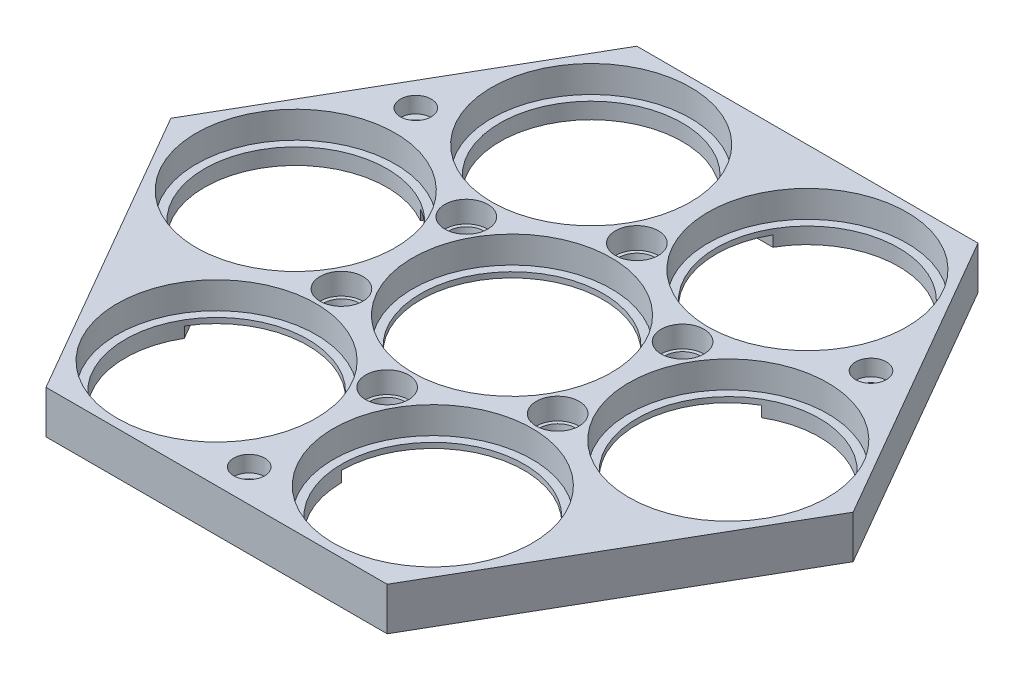
from build123d import *

# Parameters (mm, degrees)
SKETCH1_R                    = 17
BOSS_EXTRUDE1_DEPTH          = 1
SKETCH2_R                    = 18.525
BOSS_EXTRUDE2_DEPTH          = 5
CUT_EXTRUDE1_DEPTH           = 85.305303088
CUT_EXTRUDE1_DEPTH_BACK      = 4
SKETCH3_R                    = 4
SKETCH3_2_R                  = 4
CUT_EXTRUDE2_DEPTH           = 85.305303088
CUT_EXTRUDE2_DRAFT           = -9
CUT_EXTRUDE2_PROFILE_2_DEPTH = 85.305303088
CUT_EXTRUDE2_PROFILE_2_DRAFT = -9
CUT_EXTRUDE2_PROFILE_3_DEPTH = 85.305303088
CUT_EXTRUDE2_PROFILE_3_DRAFT = -9
CUT_EXTRUDE2_PROFILE_4_DEPTH = 85.305303088
CUT_EXTRUDE2_PROFILE_4_DRAFT = -9
CUT_EXTRUDE2_PROFILE_5_DEPTH = 85.305303088
CUT_EXTRUDE2_PROFILE_5_DRAFT = -9
CUT_EXTRUDE2_PROFILE_6_DEPTH = 85.305303088
CUT_EXTRUDE2_PROFILE_6_DRAFT = -9
BOSS_EXTRUDE3_START          = 2
BOSS_EXTRUDE3_DEPTH          = 2
SKETCH7_R                    = 1.55
CUT_EXTRUDE4_DEPTH           = 85.471202955
SKETCH7_3_R                  = 2.875
SKETCH7_3_R_2                = 1.55
CUT_EXTRUDE5_DEPTH           = 3


with BuildPart() as part:
    # Sketch1 → Boss-Extrude1 (new body)
    with BuildSketch(Plane(origin=(0, 0, 0), x_dir=(1, 0, 0), z_dir=(0, 1, 0))):
        Polygon((31.783607924, -55.050823773), (63.567215848, 0), (31.783607924, 55.050823773), (-31.783607924, 55.050823773), (-63.567215848, 0), (-31.783607924, -55.050823773), align=None)
        with Locations((-20.15, -34.900823773)):
            Circle(SKETCH1_R, mode=Mode.SUBTRACT)
        with Locations((20.15, -34.900823773)):
            Circle(SKETCH1_R, mode=Mode.SUBTRACT)
        with Locations((-40.3, 0)):
            Circle(SKETCH1_R, mode=Mode.SUBTRACT)
        with BuildLine():
            ThreePointArc((-17, 0), (0, 17), (17, 0))
            ThreePointArc((17, 0), (0, -17), (-17, 0))
        make_face(mode=Mode.SUBTRACT)
        with Locations((-20.15, 34.900823773)):
            Circle(SKETCH1_R, mode=Mode.SUBTRACT)
        with Locations((40.3, 0)):
            Circle(SKETCH1_R, mode=Mode.SUBTRACT)
        with Locations((20.15, 34.900823773)):
            Circle(SKETCH1_R, mode=Mode.SUBTRACT)
    extrude(amount=BOSS_EXTRUDE1_DEPTH)

    # Sketch2 → Boss-Extrude2 (add)
    with BuildSketch(Plane(origin=(0, 1, 0), x_dir=(1, 0, 0), z_dir=(0, 1, 0))):
        Polygon((63.567215848, 0), (31.783607924, 55.050823773), (-31.783607924, 55.050823773), (-63.567215848, 0), (-31.783607924, -55.050823773), (31.783607924, -55.050823773), align=None)
        with Locations((-40.3, 0)):
            Circle(SKETCH2_R, mode=Mode.SUBTRACT)
        with Locations((-20.15, 34.900823773)):
            Circle(SKETCH2_R, mode=Mode.SUBTRACT)
        with Locations((20.15, 34.900823773)):
            Circle(SKETCH2_R, mode=Mode.SUBTRACT)
        Circle(SKETCH2_R, mode=Mode.SUBTRACT)
        with Locations((40.3, 0)):
            Circle(SKETCH2_R, mode=Mode.SUBTRACT)
        with Locations((20.15, -34.900823773)):
            Circle(SKETCH2_R, mode=Mode.SUBTRACT)
        with Locations((-20.15, -34.900823773)):
            Circle(SKETCH2_R, mode=Mode.SUBTRACT)
    extrude(amount=BOSS_EXTRUDE2_DEPTH)

    # Sketch3 → Cut-Extrude1 (cut, two sides: drawn at the far end of the back side and taken through both)
    with BuildSketch(Plane(origin=(0, 6, 0), x_dir=(1, 0, 0), z_dir=(0, 1, 0)).offset(-CUT_EXTRUDE1_DEPTH_BACK)):
        with Locations((-20.15, 11.633607924)):
            Circle(SKETCH3_R)
        with Locations((20.15, 11.633607924)):
            Circle(SKETCH3_R)
        with Locations((0, -23.267215848)):
            Circle(SKETCH3_R)
        with Locations((-20.15, -11.633607924)):
            Circle(SKETCH3_R)
        with Locations((20.15, -11.633607924)):
            Circle(SKETCH3_R)
        with Locations((0, 23.267215848)):
            Circle(SKETCH3_R)
    extrude(amount=CUT_EXTRUDE1_DEPTH + CUT_EXTRUDE1_DEPTH_BACK, mode=Mode.SUBTRACT)


with BuildPart() as cut_extrude2_tool:
    # Sketch3<2> → Cut-Extrude2 (with draft: the straight prism first)
    with BuildSketch(Plane(origin=(0, 6, 0), x_dir=(1, 0, 0), z_dir=(0, 1, 0))):
        with Locations((-20.15, 11.633607924)):
            Circle(SKETCH3_2_R)
    extrude(amount=-CUT_EXTRUDE2_DEPTH)
    # Cut-Extrude2: the draft: its side faces are tilted about the plane it starts from
    cut_extrude2_sides = [cut_extrude2_tool.faces().sort_by_distance(p)[0] for p in [
        (-24.15, -36.652651544, -11.633607924),
    ]]
    draft(cut_extrude2_sides, Plane(origin=(0, 6, 0), x_dir=(1, 0, 0), z_dir=(0, 1, 0)), CUT_EXTRUDE2_DRAFT)


with BuildPart() as part_1:
    add(part.part)

    # Cut-Extrude2: cut by cut_extrude2_tool
    add(cut_extrude2_tool.part, mode=Mode.SUBTRACT)


with BuildPart() as cut_extrude2_profile_2_tool:
    # Sketch3<2> → Cut-Extrude2 profile 2 (with draft: the straight prism first)
    with BuildSketch(Plane(origin=(0, 6, 0), x_dir=(1, 0, 0), z_dir=(0, 1, 0))):
        with Locations((20.15, 11.633607924)):
            Circle(SKETCH3_2_R)
    extrude(amount=-CUT_EXTRUDE2_PROFILE_2_DEPTH)
    # Cut-Extrude2 profile 2: the draft: its side faces are tilted about the plane it starts from
    cut_extrude2_profile_2_sides = [cut_extrude2_profile_2_tool.faces().sort_by_distance(p)[0] for p in [
        (16.15, -36.652651544, -11.633607924),
    ]]
    draft(cut_extrude2_profile_2_sides, Plane(origin=(0, 6, 0), x_dir=(1, 0, 0), z_dir=(0, 1, 0)), CUT_EXTRUDE2_PROFILE_2_DRAFT)


with BuildPart() as part_2:
    add(part_1.part)

    # Cut-Extrude2 profile 2: cut by cut_extrude2_profile_2_tool
    add(cut_extrude2_profile_2_tool.part, mode=Mode.SUBTRACT)


with BuildPart() as cut_extrude2_profile_3_tool:
    # Sketch3<2> → Cut-Extrude2 profile 3 (with draft: the straight prism first)
    with BuildSketch(Plane(origin=(0, 6, 0), x_dir=(1, 0, 0), z_dir=(0, 1, 0))):
        with Locations((0, -23.267215848)):
            Circle(SKETCH3_2_R)
    extrude(amount=-CUT_EXTRUDE2_PROFILE_3_DEPTH)
    # Cut-Extrude2 profile 3: the draft: its side faces are tilted about the plane it starts from
    cut_extrude2_profile_3_sides = [cut_extrude2_profile_3_tool.faces().sort_by_distance(p)[0] for p in [
        (-4, -36.652651544, 23.267215848),
    ]]
    draft(cut_extrude2_profile_3_sides, Plane(origin=(0, 6, 0), x_dir=(1, 0, 0), z_dir=(0, 1, 0)), CUT_EXTRUDE2_PROFILE_3_DRAFT)


with BuildPart() as part_3:
    add(part_2.part)

    # Cut-Extrude2 profile 3: cut by cut_extrude2_profile_3_tool
    add(cut_extrude2_profile_3_tool.part, mode=Mode.SUBTRACT)


with BuildPart() as cut_extrude2_profile_4_tool:
    # Sketch3<2> → Cut-Extrude2 profile 4 (with draft: the straight prism first)
    with BuildSketch(Plane(origin=(0, 6, 0), x_dir=(1, 0, 0), z_dir=(0, 1, 0))):
        with Locations((-20.15, -11.633607924)):
            Circle(SKETCH3_2_R)
    extrude(amount=-CUT_EXTRUDE2_PROFILE_4_DEPTH)
    # Cut-Extrude2 profile 4: the draft: its side faces are tilted about the plane it starts from
    cut_extrude2_profile_4_sides = [cut_extrude2_profile_4_tool.faces().sort_by_distance(p)[0] for p in [
        (-24.15, -36.652651544, 11.633607924),
    ]]
    draft(cut_extrude2_profile_4_sides, Plane(origin=(0, 6, 0), x_dir=(1, 0, 0), z_dir=(0, 1, 0)), CUT_EXTRUDE2_PROFILE_4_DRAFT)


with BuildPart() as part_4:
    add(part_3.part)

    # Cut-Extrude2 profile 4: cut by cut_extrude2_profile_4_tool
    add(cut_extrude2_profile_4_tool.part, mode=Mode.SUBTRACT)


with BuildPart() as cut_extrude2_profile_5_tool:
    # Sketch3<2> → Cut-Extrude2 profile 5 (with draft: the straight prism first)
    with BuildSketch(Plane(origin=(0, 6, 0), x_dir=(1, 0, 0), z_dir=(0, 1, 0))):
        with Locations((20.15, -11.633607924)):
            Circle(SKETCH3_2_R)
    extrude(amount=-CUT_EXTRUDE2_PROFILE_5_DEPTH)
    # Cut-Extrude2 profile 5: the draft: its side faces are tilted about the plane it starts from
    cut_extrude2_profile_5_sides = [cut_extrude2_profile_5_tool.faces().sort_by_distance(p)[0] for p in [
        (16.15, -36.652651544, 11.633607924),
    ]]
    draft(cut_extrude2_profile_5_sides, Plane(origin=(0, 6, 0), x_dir=(1, 0, 0), z_dir=(0, 1, 0)), CUT_EXTRUDE2_PROFILE_5_DRAFT)


with BuildPart() as part_5:
    add(part_4.part)

    # Cut-Extrude2 profile 5: cut by cut_extrude2_profile_5_tool
    add(cut_extrude2_profile_5_tool.part, mode=Mode.SUBTRACT)


with BuildPart() as cut_extrude2_profile_6_tool:
    # Sketch3<2> → Cut-Extrude2 profile 6 (with draft: the straight prism first)
    with BuildSketch(Plane(origin=(0, 6, 0), x_dir=(1, 0, 0), z_dir=(0, 1, 0))):
        with Locations((0, 23.267215848)):
            Circle(SKETCH3_2_R)
    extrude(amount=-CUT_EXTRUDE2_PROFILE_6_DEPTH)
    # Cut-Extrude2 profile 6: the draft: its side faces are tilted about the plane it starts from
    cut_extrude2_profile_6_sides = [cut_extrude2_profile_6_tool.faces().sort_by_distance(p)[0] for p in [
        (-4, -36.652651544, -23.267215848),
    ]]
    draft(cut_extrude2_profile_6_sides, Plane(origin=(0, 6, 0), x_dir=(1, 0, 0), z_dir=(0, 1, 0)), CUT_EXTRUDE2_PROFILE_6_DRAFT)


with BuildPart() as part_6:
    add(part_5.part)

    # Cut-Extrude2 profile 6: cut by cut_extrude2_profile_6_tool
    add(cut_extrude2_profile_6_tool.part, mode=Mode.SUBTRACT)

    # Sketch5 → Boss-Extrude3 (add)
    with BuildSketch(Plane.XZ.offset(BOSS_EXTRUDE3_START)):
        Polygon((-31.783607924, -55.050823773), (31.783607924, -55.050823773), (63.567215848, 0), (31.783607924, 55.050823773), (-31.783607924, 55.050823773), (-63.567215848, 0), align=None)
        with BuildLine():
            ThreePointArc((-31.8, -14.722431864), (-56.740483978, -4.325561993), (-40.146124932, 16.999303588))
            Line((-40.146124932, 16.999303588), (-34.794891219, 26.267912261))
            ThreePointArc((-34.794891219, 26.267912261), (-24.624195418, 51.301481545), (-3.15, 34.900823773))
            Line((-3.15, 34.900823773), (3.15, 34.900823773))
            ThreePointArc((3.15, 34.900823773), (24.624195418, 51.301481545), (34.794891219, 26.267912261))
            Line((34.794891219, 26.267912261), (40.146124932, 16.999303588))
            ThreePointArc((40.146124932, 16.999303588), (56.740483978, -4.325561993), (31.8, -14.722431864))
            Line((31.8, -14.722431864), (28.65, -20.178391908))
            ThreePointArc((28.65, -20.178391908), (32.116288561, -46.975919552), (5.351233712, -43.267215848))
            Line((5.351233712, -43.267215848), (-5.351233712, -43.267215848))
            ThreePointArc((-5.351233712, -43.267215848), (-32.116288561, -46.975919552), (-28.65, -20.178391908))
            Line((-28.65, -20.178391908), (-31.8, -14.722431864))
        make_face(mode=Mode.SUBTRACT)
    extrude(amount=-BOSS_EXTRUDE3_DEPTH)

    # Sketch7 → Cut-Extrude4 (cut, through all)
    with BuildSketch(Plane(origin=(0, 6, 0), x_dir=(1, 0, 0), z_dir=(0, 1, 0))):
        with Locations((-42.409454211, 24.485109805)):
            Circle(SKETCH7_R)
        with Locations((42.409454211, 24.485109805)):
            Circle(SKETCH7_R)
        with Locations((0, -48.97021961)):
            Circle(SKETCH7_R)
    extrude(amount=-CUT_EXTRUDE4_DEPTH, mode=Mode.SUBTRACT)

    # Sketch7<3> → Cut-Extrude5 (cut)
    # profile 1 of 3: a face of its own
    with BuildSketch(Plane(origin=(0, 6, 0), x_dir=(1, 0, 0), z_dir=(0, 1, 0))):
        with Locations((-42.409454211, 24.485109805)):
            Circle(SKETCH7_3_R)
        with Locations((-42.409454211, 24.485109805)):
            Circle(SKETCH7_3_R_2, mode=Mode.SUBTRACT)
    # profile 2 of 3: a face of its own
    with BuildSketch(Plane(origin=(0, 6, 0), x_dir=(1, 0, 0), z_dir=(0, 1, 0))):
        with Locations((42.409454211, 24.485109805)):
            Circle(SKETCH7_3_R)
    # profile 3 of 3: a face of its own
    with BuildSketch(Plane(origin=(0, 6, 0), x_dir=(1, 0, 0), z_dir=(0, 1, 0))):
        with Locations((0, -48.97021961)):
            Circle(SKETCH7_3_R)
    extrude(amount=-CUT_EXTRUDE5_DEPTH, mode=Mode.SUBTRACT)


solid = part_6.part
